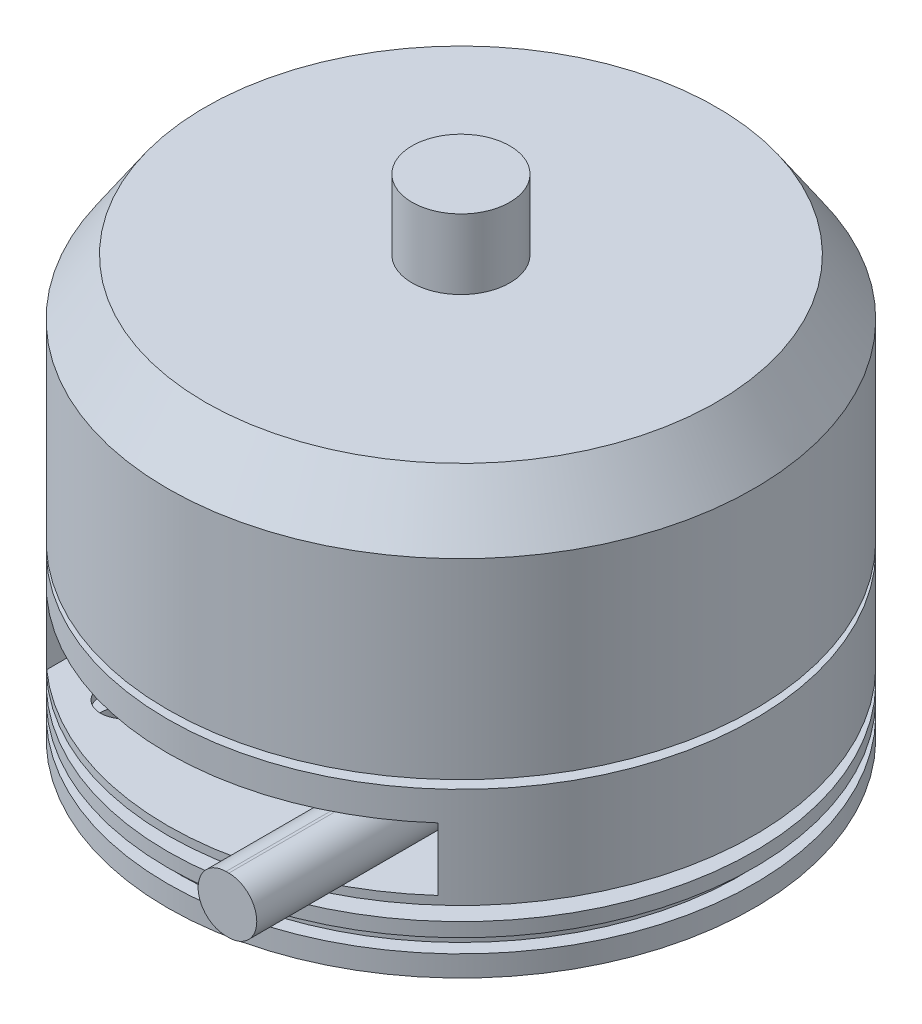
from build123d import *

# Parameters (mm, degrees)
SKETCH_2_W             = 28
SKETCH_2_H             = 4.5
CUT_EXTRUDE_1_DEPTH    = 10
EXTRUDE_1_DEPTH        = 15
HOLE_WIZARD_M4_2_D     = 3.3
HOLE_WIZARD_M4_2_DEPTH = 10.5
HOLE_WIZARD_M4_2_TIP   = 0.991420021


with BuildPart() as part:
    # 草图1 → 旋转1 (revolve)
    with BuildSketch(Plane.XY, mode=Mode.PRIVATE) as revolve_1_sk:
        Polygon((0, 0), (4.1, 0), (4.1, 6.7), (13.4, 6.7), (13.4, 8.7), (21, 8.7), (21, 10.2), (20, 10.2), (20, 11.2), (21, 11.2), (21, 12.2), (10, 12.2), (10, 13.2), (21, 13.2), (21, 20.4), (5, 20.4), (5, 21), (21, 21), (21, 34.7), (18.3, 38.7), (3.5, 38.7), (3.5, 43.7), (0, 43.7), align=None)
    revolve(revolve_1_sk.sketch.rotate(Axis((0, 43.7, 0), (0, -1, 0)), 90), axis=Axis((0, 43.7, 0), (0, -1, 0)))

    # 草图2 → 切除-拉伸1 (cut)
    with BuildSketch(Plane.XY.offset(21)):
        with Locations((0, 16.05)):
            Rectangle(SKETCH_2_W, SKETCH_2_H)
    extrude(amount=-CUT_EXTRUDE_1_DEPTH, mode=Mode.SUBTRACT)

    # 草图3 → 凸台-拉伸1 (add)
    with BuildSketch(Plane.XY.offset(11)):
        with BuildLine():
            Line((9.185056323, 18.053194417), (9.385056323, 18.053194417))
            ThreePointArc((9.385056323, 18.053194417), (11.385056323, 16.053194417), (9.385056323, 14.053194417))
            Line((9.385056323, 14.053194417), (9.185056323, 14.053194417))
            ThreePointArc((9.185056323, 14.053194417), (7.185056323, 16.053194417), (9.185056323, 18.053194417))
        make_face()
    extrude(amount=EXTRUDE_1_DEPTH)

    # M4 螺纹孔2
    with Locations(Plane(origin=(-14.780985523, 8.7, -9.368696119), x_dir=(0, 0, -1), z_dir=(0, -1, 0))):
        with Locations((0, 0), (-24.149681642, 5.412289404), (5.412289404, 24.149681642), (-18.737392238, 29.561971046)):
            Hole(HOLE_WIZARD_M4_2_D / 2, depth=HOLE_WIZARD_M4_2_DEPTH)
            with Locations((0, 0, -(HOLE_WIZARD_M4_2_DEPTH + HOLE_WIZARD_M4_2_TIP / 2))):  # 118° drill point
                Cone(0, HOLE_WIZARD_M4_2_D / 2, HOLE_WIZARD_M4_2_TIP, mode=Mode.SUBTRACT)


solid = part.part
